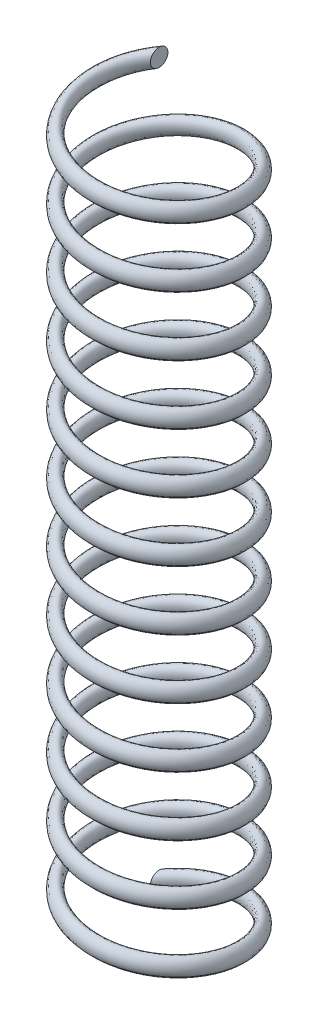
from build123d import *

# Parameters (mm, degrees)
SWEEP1_PITCH       = 10.166666667
SWEEP1_HEIGHT      = 122
SWEEP1_RADIUS      = 12.5
SWEEP1_START_ANGLE = -135
SKETCH2_R          = 1.5


with BuildPart() as part:
    # Sweep1: sweep along a helix
    with BuildLine() as sweep1_path:
        add(Helix(SWEEP1_PITCH, SWEEP1_HEIGHT, SWEEP1_RADIUS, center=(0, 0, 0), direction=(0, 1, 0), lefthand=True, mode=Mode.PRIVATE).rotate(Axis((0, 0, 0), (0, 1, 0)), SWEEP1_START_ANGLE))
    # Sketch2 → Sweep1 (sweep)
    with BuildSketch(Plane(origin=(-8.838834765, 0, 0), x_dir=(0, 0, -1), z_dir=(1, 0, 0))):
        with Locations((8.867932773, 0)):
            Circle(SKETCH2_R)
    sweep(path=sweep1_path.line, is_frenet=True)


solid = part.part
